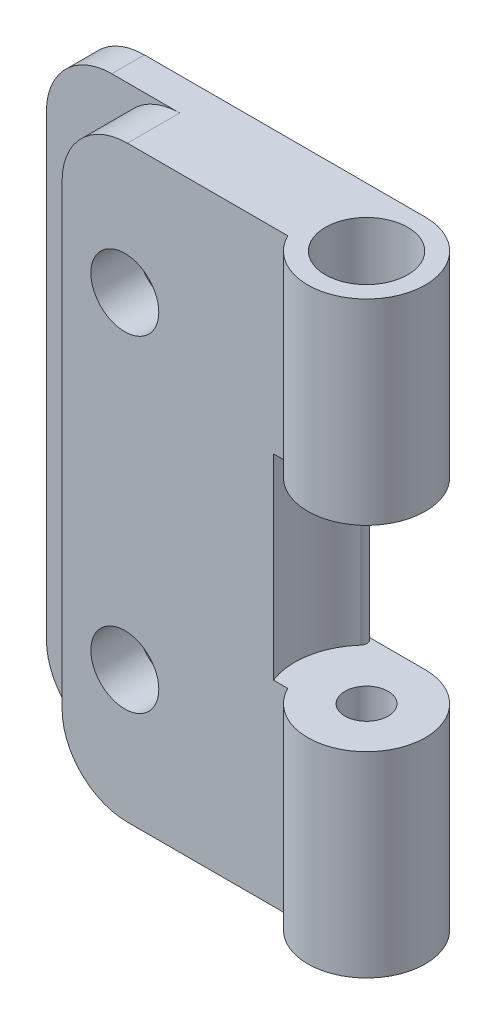
from build123d import *

# Parameters (mm, degrees)
BOSS_EXTRUDE1_DEPTH = 45
BOSS_EXTRUDE2_START = 30
SKETCH1_3_R         = 4.5
SKETCH1_3_R_2       = 1.65
BOSS_EXTRUDE2_DEPTH = 15
SKETCH1_4_R         = 4.5
SKETCH1_4_R_2       = 1.65
BOSS_EXTRUDE3_DEPTH = 15
SKETCH5_R           = 5.5
CUT_EXTRUDE1_DEPTH  = 15
SKETCH6_R           = 2.6
CUT_EXTRUDE2_DEPTH  = 15
FILLET1_R           = 0.5
CUT_EXTRUDE3_START  = -2.5
SKETCH7_R           = 5.5
CUT_EXTRUDE3_DEPTH  = 13
SKETCH1_5_R         = 1.65
CUT_EXTRUDE4_DEPTH  = 10
SKETCH9_R           = 3.15
CUT_EXTRUDE5_DEPTH  = 10
SKETCH8_R           = 3.001117943
SKETCH8_R_2         = 3.734433125
BOSS_EXTRUDE5_DEPTH = 0.4
CUT_EXTRUDE6_START  = -2.5
SKETCH10_W          = 5.2
SKETCH10_H          = 45
CUT_EXTRUDE6_DEPTH  = 10
FILLET2_R           = 5


with BuildPart() as part:
    # Sketch1 → Boss-Extrude1 (new body)
    with BuildSketch(Plane(origin=(0, 0, 0), x_dir=(1, 0, 0), z_dir=(0, 1, 0))):
        with BuildLine():
            Line((-26.5, 4.5), (-26.5, -2))
            Line((-26.5, -2), (-4.031128874, -2))
            ThreePointArc((-4.031128874, -2), (-3.824264635, 2.371708245), (0, 4.5))
            Line((0, 4.5), (-26.5, 4.5))
        make_face()
    extrude(amount=BOSS_EXTRUDE1_DEPTH)

    # Sketch1<3> → Boss-Extrude2 (add)
    with BuildSketch(Plane(origin=(0, 0, 0), x_dir=(1, 0, 0), z_dir=(0, 1, 0)).offset(BOSS_EXTRUDE2_START)):
        Circle(SKETCH1_3_R)
        with Locations(Location((0, 0, 0), (0, 0, 270))):
            Circle(SKETCH1_3_R_2, mode=Mode.SUBTRACT)
    extrude(amount=BOSS_EXTRUDE2_DEPTH)

    # Sketch1<4> → Boss-Extrude3 (add)
    # profile 1 of 2: a face of its own
    with BuildSketch(Plane(origin=(0, 0, 0), x_dir=(1, 0, 0), z_dir=(0, 1, 0))):
        Circle(SKETCH1_4_R)
        Polygon((-2.857883832, -1.65), (0, -3.3), (2.857883832, -1.65), (2.857883832, 1.65), (0, 3.3), (-2.857883832, 1.65), align=None, mode=Mode.SUBTRACT)
    # profile 2 of 2: a face of its own
    with BuildSketch(Plane(origin=(0, 0, 0), x_dir=(1, 0, 0), z_dir=(0, 1, 0))):
        Polygon((-2.857883832, 1.65), (-2.857883832, -1.65), (0, -3.3), (2.857883832, -1.65), (2.857883832, 1.65), (0, 3.3), align=None)
        with Locations(Location((0, 0, 0), (0, 0, 270))):
            Circle(SKETCH1_4_R_2, mode=Mode.SUBTRACT)
    extrude(amount=BOSS_EXTRUDE3_DEPTH)

    # Sketch5 → Cut-Extrude1 (cut)
    with BuildSketch(Plane(origin=(0, 15, 0), x_dir=(1, 0, 0), z_dir=(0, 1, 0))):
        Circle(SKETCH5_R)
    extrude(amount=CUT_EXTRUDE1_DEPTH, mode=Mode.SUBTRACT)

    # Sketch6 → Cut-Extrude2 (cut)
    with BuildSketch(Plane.XY.offset(2)):
        with Locations((-16.5, 35)):
            Circle(SKETCH6_R)
        with Locations((-16.5, 10)):
            Circle(SKETCH6_R)
    extrude(amount=-CUT_EXTRUDE2_DEPTH, mode=Mode.SUBTRACT)

    # Fillet1
    fillet1_edges = [part.edges().sort_by_distance(p)[0] for p in [
        (-3.16227766, 22.5, -4.5),
    ]]
    fillet(fillet1_edges, radius=FILLET1_R)

    # Sketch7 → Cut-Extrude3 (cut)
    with BuildSketch(Plane(origin=(0, 0, -4.5), x_dir=(-1, 0, 0), z_dir=(0, 0, -1)).offset(CUT_EXTRUDE3_START)):
        with Locations((16.5, 35)):
            Circle(SKETCH7_R)
        with Locations((16.5, 10)):
            Circle(SKETCH7_R)
    extrude(amount=CUT_EXTRUDE3_DEPTH, mode=Mode.SUBTRACT)

    # Sketch1<5> → Cut-Extrude4 (cut)
    with BuildSketch(Plane(origin=(0, 0, 0), x_dir=(1, 0, 0), z_dir=(0, 1, 0))):
        Polygon((-2.857883832, 1.65), (-2.857883832, -1.65), (0, -3.3), (2.857883832, -1.65), (2.857883832, 1.65), (0, 3.3), align=None)
        with Locations(Location((0, 0, 0), (0, 0, 270))):
            Circle(SKETCH1_5_R, mode=Mode.SUBTRACT)
    extrude(amount=CUT_EXTRUDE4_DEPTH, mode=Mode.SUBTRACT)

    # Sketch9 → Cut-Extrude5 (cut)
    with BuildSketch(Plane(origin=(0, 45, 0), x_dir=(1, 0, 0), z_dir=(0, 1, 0))):
        with Locations(Location((0, 0, 0), (0, 0, 270))):
            Circle(SKETCH9_R)
    extrude(amount=-CUT_EXTRUDE5_DEPTH, mode=Mode.SUBTRACT)

    # Sketch8 → Boss-Extrude5 (add)
    with BuildSketch(Plane(origin=(0, 0, -2), x_dir=(-1, 0, 0), z_dir=(0, 0, -1))):
        with Locations((16.5, 35)):
            Circle(SKETCH8_R)
        with Locations((16.5, 10)):
            Circle(SKETCH8_R_2)
    extrude(amount=-BOSS_EXTRUDE5_DEPTH)

    # Sketch10 → Cut-Extrude6 (cut)
    with BuildSketch(Plane(origin=(0, 0, -4.5), x_dir=(-1, 0, 0), z_dir=(0, 0, -1)).offset(CUT_EXTRUDE6_START)):
        with Locations((23.9, 22.5)):
            Rectangle(SKETCH10_W, SKETCH10_H)
    extrude(amount=-CUT_EXTRUDE6_DEPTH, mode=Mode.SUBTRACT)

    # Fillet2
    fillet2_edges = [part.edges().sort_by_distance(p)[0] for p in [
        (-26.5, 45, -3.25),
        (-21.3, 45, 0),
        (-26.5, 0, -3.25),
        (-21.3, 0, 0),
    ]]
    fillet(fillet2_edges, radius=FILLET2_R)


solid = part.part
